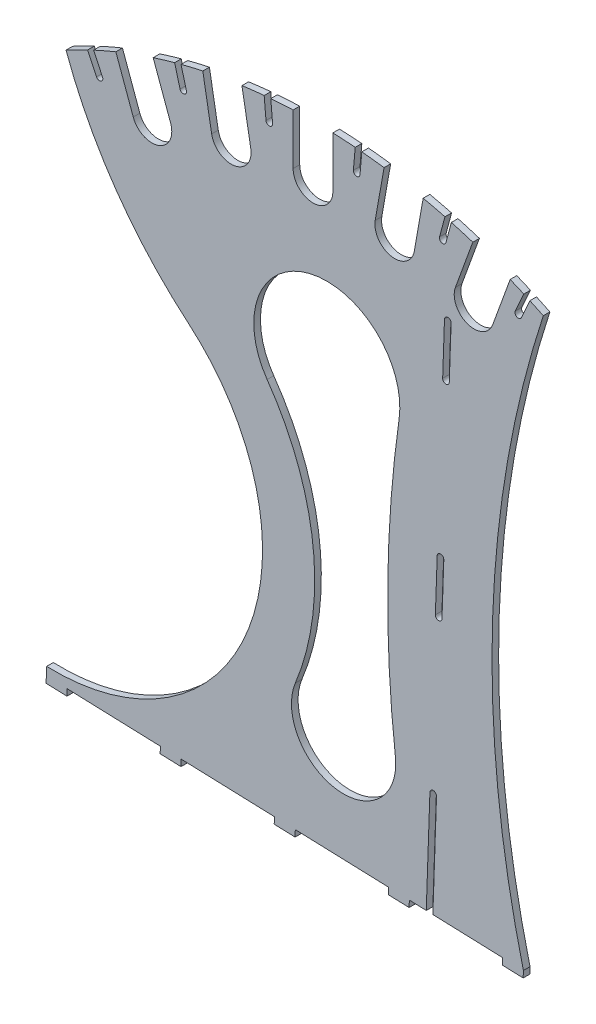
from build123d import *

# Parameters (mm, degrees)
BOSS_EXTRUDE1_DEPTH = 1.5875
CUT_EXTRUDE1_DEPTH  = 10
CUT_EXTRUDE2_DEPTH  = 399.337162784


with BuildPart() as part:
    # Sketch1 → Boss-Extrude1 (new, symmetric)
    with BuildSketch(Plane.XY):
        with BuildLine():
            Line((118.523395286, 71.943678131), (118.634293919, 75.116740767))
            ThreePointArc((118.634293919, 75.116740767), (103.883786228, 214.067962894), (128.160173541, 351.674927204))
            ThreePointArc((128.160173541, 351.674927204), (120.284402828, 355.375683964), (112.284762731, 358.800464724))
            Line((112.284762731, 358.800464724), (103.942723114, 335.880899242))
            ThreePointArc((103.942723114, 335.880899242), (91.734409036, 330.188068894), (86.041578688, 342.396382972))
            Line((86.041578688, 342.396382972), (94.383618305, 365.315948454))
            ThreePointArc((94.383618305, 365.315948454), (82.568877465, 368.795382466), (70.597294753, 371.689474641))
            Line((70.597294753, 371.689474641), (66.36193024, 347.669528881))
            ThreePointArc((66.36193024, 347.669528881), (55.3276375, 339.943233926), (47.601342545, 350.977526666))
            Line((47.601342545, 350.977526666), (51.836707058, 374.997472425))
            ThreePointArc((51.836707058, 374.997472425), (39.597261303, 376.3724378), (27.305, 377.14371869))
            Line((27.305, 377.14371869), (27.305, 352.825))
            ThreePointArc((27.305, 352.825), (17.78, 343.3), (8.255, 352.825))
            Line((8.255, 352.825), (8.255, 377.14371869))
            ThreePointArc((8.255, 377.14371869), (-4.037261303, 376.3724378), (-16.276707058, 374.997472425))
            Line((-16.276707058, 374.997472425), (-12.041342545, 350.977526666))
            ThreePointArc((-12.041342545, 350.977526666), (-19.7676375, 339.943233926), (-30.80193024, 347.669528881))
            Line((-30.80193024, 347.669528881), (-35.037294753, 371.689474641))
            ThreePointArc((-35.037294753, 371.689474641), (-47.008877465, 368.795382466), (-58.823618305, 365.315948454))
            Line((-58.823618305, 365.315948454), (-50.481578688, 342.396382972))
            ThreePointArc((-50.481578688, 342.396382972), (-56.174409036, 330.188068894), (-68.382723114, 335.880899242))
            Line((-68.382723114, 335.880899242), (-76.724762731, 358.800464724))
            ThreePointArc((-76.724762731, 358.800464724), (-88.8119245, 353.496726812), (-100.602714669, 347.563230147))
            ThreePointArc((-100.602714669, 347.563230147), (-76.713636703, 301.658133404), (-41.846325708, 263.418931306))
            ThreePointArc((-41.846325708, 263.418931306), (-13.109519742, 151.040608787), (-109.894880363, 87.108728174))
            Line((-109.894880363, 87.108728174), (-110.145579114, 79.935665538))
            Line((-110.145579114, 79.935665538), (-100.151681047, 79.586378505))
            Line((-100.151681047, 79.586378505), (-100.040782415, 82.759441142))
            Line((-100.040782415, 82.759441142), (-55.365911398, 81.198053081))
            Line((-55.365911398, 81.198053081), (-55.476810031, 78.024990444))
            Line((-55.476810031, 78.024990444), (-45.482911964, 77.675703412))
            Line((-45.482911964, 77.675703412), (-45.372013331, 80.848766048))
            Line((-45.372013331, 80.848766048), (-0.697142315, 79.287377987))
            Line((-0.697142315, 79.287377987), (-0.808040947, 76.114315351))
            Line((-0.808040947, 76.114315351), (9.185857119, 75.765028318))
            Line((9.185857119, 75.765028318), (9.296755752, 78.938090955))
            Line((9.296755752, 78.938090955), (53.971626769, 77.376702893))
            Line((53.971626769, 77.376702893), (53.860728136, 74.203640257))
            Line((53.860728136, 74.203640257), (63.854626203, 73.854353225))
            Line((63.854626203, 73.854353225), (63.965524835, 77.027415861))
            Line((63.965524835, 77.027415861), (72.0752213, 76.74398173))
            Line((72.0752213, 76.74398173), (73.821656463, 126.713472064))
            ThreePointArc((73.821656463, 126.713472064), (75.463637097, 128.244554066), (76.994719099, 126.602573431))
            Line((76.994719099, 126.602573431), (75.248283936, 76.633083097))
            Line((75.248283936, 76.633083097), (108.640395852, 75.4660278))
            Line((108.640395852, 75.4660278), (108.529497219, 72.292965164))
            Line((108.529497219, 72.292965164), (118.523395286, 71.943678131))
        make_face()
        with BuildLine():
            Line((79.934179532, 301.606688232), (80.807397113, 326.591433399))
            ThreePointArc((80.807397113, 326.591433399), (82.449377747, 328.122515401), (83.980459749, 326.480534766))
            Line((83.980459749, 326.480534766), (83.107242168, 301.4957896))
            ThreePointArc((83.107242168, 301.4957896), (81.465261533, 299.964707598), (79.934179532, 301.606688232))
        make_face(mode=Mode.SUBTRACT)
        with BuildLine():
            ThreePointArc((79.614371843, 201.556808932), (77.972391208, 200.02572693), (76.441309207, 201.667707565))
            Line((76.441309207, 201.667707565), (77.314526788, 226.652452732))
            ThreePointArc((77.314526788, 226.652452732), (78.956507422, 228.183534733), (80.487589424, 226.541554099))
            Line((80.487589424, 226.541554099), (79.614371843, 201.556808932))
        make_face(mode=Mode.SUBTRACT)
    extrude(amount=BOSS_EXTRUDE1_DEPTH, both=True)

    # Sketch2 → Cut-Extrude1 (cut)
    with BuildSketch(Plane.XY.offset(1.5875)):
        with BuildLine():
            ThreePointArc((59.060719004, 274.255221739), (16.218243133, 313.208722852), (-4.20589422, 259.026552342))
            ThreePointArc((-4.20589422, 259.026552342), (17.803012445, 201.122949157), (9.309397428, 139.762719868))
            ThreePointArc((9.309397428, 139.762719868), (29.062919552, 105.536460681), (57.283668785, 133.199211213))
            ThreePointArc((57.283668785, 133.199211213), (53.631087043, 203.784426197), (59.060719004, 274.255221739))
        make_face()
    extrude(amount=-CUT_EXTRUDE1_DEPTH, mode=Mode.SUBTRACT)

    # Sketch3 → Cut-Extrude2 (cut, through all)
    with BuildSketch(Plane.XY.offset(1.5875)):
        with BuildLine():
            Line((-87.375537588, 354.172706758), (-83.117396192, 345.124600224))
            ThreePointArc((-83.117396192, 345.124600224), (-83.877803157, 343.012233365), (-85.990170016, 343.772640331))
            Line((-85.990170016, 343.772640331), (-90.248311413, 352.820746865))
            ThreePointArc((-90.248311413, 352.820746865), (-89.487904447, 354.933113724), (-87.375537588, 354.172706758))
        make_face()
        with BuildLine():
            Line((-45.475470216, 369.2062577), (-42.887279765, 359.546999437))
            ThreePointArc((-42.887279765, 359.546999437), (-44.00981178, 357.602716954), (-45.954094263, 358.725248969))
            Line((-45.954094263, 358.725248969), (-48.542284715, 368.384507232))
            ThreePointArc((-48.542284715, 368.384507232), (-47.419752699, 370.328789715), (-45.475470216, 369.2062577))
        make_face()
        with BuildLine():
            Line((-2.45580222, 376.510797541), (-1.584244793, 366.548850561))
            ThreePointArc((-1.584244793, 366.548850561), (-3.027344134, 364.829031736), (-4.747162959, 366.272131077))
            Line((-4.747162959, 366.272131077), (-5.618720387, 376.234078058))
            ThreePointArc((-5.618720387, 376.234078058), (-4.175621045, 377.953896883), (-2.45580222, 376.510797541))
        make_face()
        with BuildLine():
            Line((41.178720387, 376.234078058), (40.307162959, 366.272131077))
            ThreePointArc((40.307162959, 366.272131077), (38.587344134, 364.829031736), (37.144244793, 366.548850561))
            Line((37.144244793, 366.548850561), (38.01580222, 376.510797541))
            ThreePointArc((38.01580222, 376.510797541), (39.735621045, 377.953896883), (41.178720387, 376.234078058))
        make_face()
        with BuildLine():
            Line((84.102284715, 368.384507232), (81.514094263, 358.725248969))
            ThreePointArc((81.514094263, 358.725248969), (79.56981178, 357.602716954), (78.447279765, 359.546999437))
            Line((78.447279765, 359.546999437), (81.035470216, 369.2062577))
            ThreePointArc((81.035470216, 369.2062577), (82.979752699, 370.328789715), (84.102284715, 368.384507232))
        make_face()
        with BuildLine():
            Line((121.732705627, 354.725626081), (117.637852823, 345.60245884))
            ThreePointArc((117.637852823, 345.60245884), (115.539492141, 344.804213923), (114.741247224, 346.902574605))
            Line((114.741247224, 346.902574605), (118.836100028, 356.025741846))
            ThreePointArc((118.836100028, 356.025741846), (120.934460711, 356.823986763), (121.732705627, 354.725626081))
        make_face()
    extrude(amount=-CUT_EXTRUDE2_DEPTH, mode=Mode.SUBTRACT)


solid = part.part
